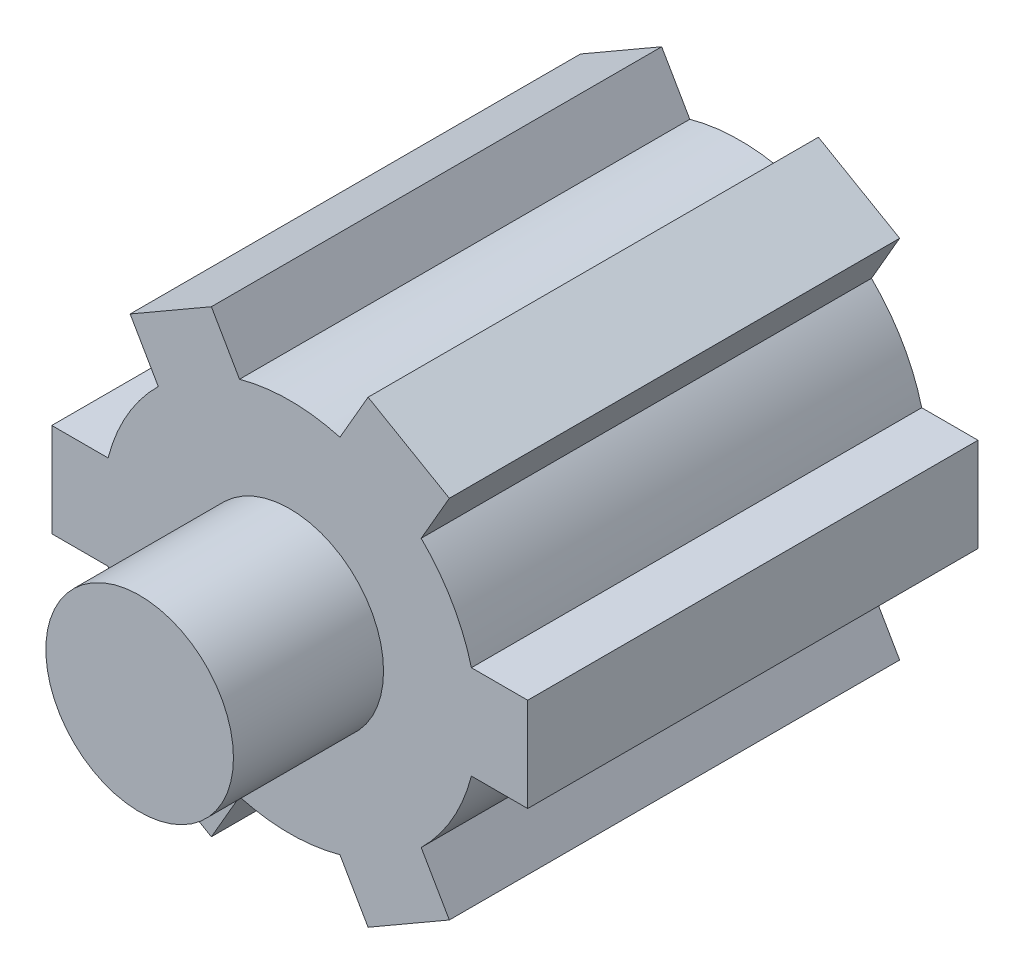
from build123d import *

# Parameters (mm, degrees)
BOSS_EXTRUDE1_DEPTH = 9.525
SKETCH2_R           = 3.96875
BOSS_EXTRUDE2_DEPTH = 6.35


with BuildPart() as part:
    # Sketch1 → Boss-Extrude1 (new, symmetric)
    with BuildSketch(Plane.XY):
        with BuildLine():
            Line((-10.066701328, 1.984375), (-10.066701328, -1.984375))
            Line((-10.066701328, -1.984375), (-7.685451328, -1.984375))
            ThreePointArc((-7.685451328, -1.984375), (-6.874076643, -3.96875), (-5.561244824, -5.663608589))
            Line((-5.561244824, -5.663608589), (-6.751869824, -7.725831582))
            Line((-6.751869824, -7.725831582), (-3.314831503, -9.710206582))
            Line((-3.314831503, -9.710206582), (-2.124206503, -7.647983589))
            ThreePointArc((-2.124206503, -7.647983589), (0, -7.9375), (2.124206503, -7.647983589))
            Line((2.124206503, -7.647983589), (3.314831503, -9.710206582))
            Line((3.314831503, -9.710206582), (6.751869824, -7.725831582))
            Line((6.751869824, -7.725831582), (5.561244824, -5.663608589))
            ThreePointArc((5.561244824, -5.663608589), (6.874076643, -3.96875), (7.685451328, -1.984375))
            Line((7.685451328, -1.984375), (10.066701328, -1.984375))
            Line((10.066701328, -1.984375), (10.066701328, 1.984375))
            Line((10.066701328, 1.984375), (7.685451328, 1.984375))
            ThreePointArc((7.685451328, 1.984375), (6.874076643, 3.96875), (5.561244824, 5.663608589))
            Line((5.561244824, 5.663608589), (6.751869824, 7.725831582))
            Line((6.751869824, 7.725831582), (3.314831503, 9.710206582))
            Line((3.314831503, 9.710206582), (2.124206503, 7.647983589))
            ThreePointArc((2.124206503, 7.647983589), (0, 7.9375), (-2.124206503, 7.647983589))
            Line((-2.124206503, 7.647983589), (-3.314831503, 9.710206582))
            Line((-3.314831503, 9.710206582), (-6.751869824, 7.725831582))
            Line((-6.751869824, 7.725831582), (-5.561244824, 5.663608589))
            ThreePointArc((-5.561244824, 5.663608589), (-6.874076643, 3.96875), (-7.685451328, 1.984375))
            Line((-7.685451328, 1.984375), (-10.066701328, 1.984375))
        make_face()
    extrude(amount=BOSS_EXTRUDE1_DEPTH, both=True)

    # Sketch2 → Boss-Extrude2 (add)
    with BuildSketch(Plane.XY.offset(9.525)):
        Circle(SKETCH2_R)
    extrude(amount=BOSS_EXTRUDE2_DEPTH)


solid = part.part
